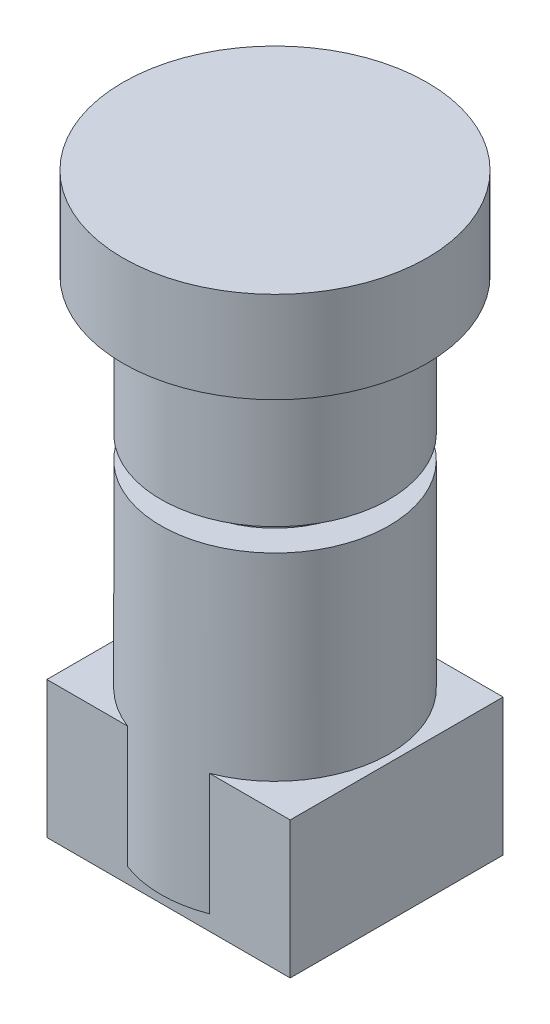
from build123d import *

# Parameters (mm, degrees)
SK_P02_CONTACTBLOCKSNC1NC2_W  = 32
SK_P02_CONTACTBLOCKSNC1NC2_H  = 28
P02_CONTACTBLOCKSNC1NC2_DEPTH = 18


with BuildPart() as part:
    # SK_P01_Mushroomandbody → P01_Mushroomandbody (revolve)
    with BuildSketch(Plane.XY, mode=Mode.PRIVATE) as p01_mushroomandbody_sk:
        Polygon((0, 2), (15, 2), (15, 44), (11, 44), (11, 47), (15, 47), (15, 65), (20, 65), (20, 77), (0, 77), align=None)
    revolve(p01_mushroomandbody_sk.sketch.rotate(Axis((0, -3, 0), (0, 1, 0)), 90), axis=Axis((0, -3, 0), (0, 1, 0)))

    # SK_P02_ContactblocksNC1NC2 → P02_ContactblocksNC1NC2 (add)
    with BuildSketch(Plane(origin=(0, 0, 0), x_dir=(1, 0, 0), z_dir=(0, 1, 0))):
        Rectangle(SK_P02_CONTACTBLOCKSNC1NC2_W, SK_P02_CONTACTBLOCKSNC1NC2_H)
    extrude(amount=P02_CONTACTBLOCKSNC1NC2_DEPTH)


solid = part.part
